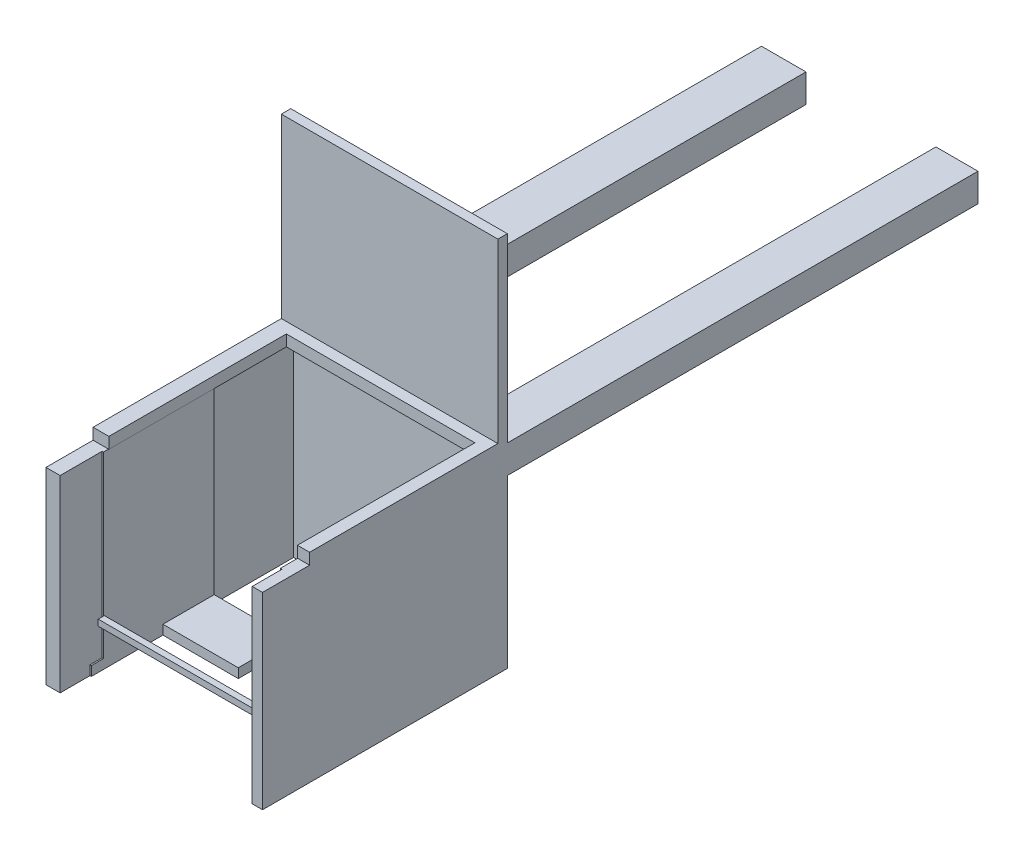
from build123d import *

# Parameters (mm, degrees)
SKETCH_1_W           = 10
SKETCH_1_H           = 200
EXTRUDE_1_DEPTH      = 230
SKETCH_3_W           = 230
SKETCH_3_H           = 10
EXTRUDE_2_DEPTH      = 200
SKETCH_4_W           = 230
SKETCH_4_H           = 200
EXTRUDE_3_DEPTH      = 250
SKETCH_5_W           = 39.107317094
SKETCH_5_H           = 28.520826202
EXTRUDE_4_DEPTH      = 600
SKETCH_6_W           = 42.946967528
SKETCH_6_H           = 25.292733119
EXTRUDE_5_DEPTH      = 600
SKETCH_8_W           = 204.071070321
SKETCH_8_H           = 31.645680933
CUT_EXTRUDE_1_DEPTH  = 600
SKETCH_9_W           = 200.890651603
SKETCH_9_H           = 63.14903284
CUT_EXTRUDE_2_DEPTH  = 600
SKETCH_10_W          = 202.520583334
SKETCH_10_H          = 86.479719268
CUT_EXTRUDE_3_DEPTH  = 600
SKETCH_11_W          = 44.998390002
SKETCH_11_H          = 54.43327072
CUT_EXTRUDE_4_DEPTH  = 600
SKETCH_12_W          = 80.01436718
SKETCH_12_H          = 54.43327072
CUT_EXTRUDE_6_DEPTH  = 190
SKETCH_13_W          = 75.520724131
SKETCH_13_H          = 54.43327072
CUT_EXTRUDE_7_DEPTH  = 190
SKETCH_14_W          = 202.325132129
SKETCH_14_H          = 13.002129503
CUT_EXTRUDE_8_DEPTH  = 190
SKETCH_15_W          = 230
SKETCH_15_H          = 11.90568545
EXTRUDE_6_DEPTH      = 200
SKETCH_16_W          = 200.306698776
SKETCH_16_H          = 188.520008931
CUT_EXTRUDE_9_DEPTH  = 50
SKETCH_17_W          = 202.636589795
SKETCH_17_H          = 13.002129503
CUT_EXTRUDE_10_DEPTH = 50
SKETCH_18_W          = 6.501064751
SKETCH_18_H          = 6.501064751
EXTRUDE_9_DEPTH      = 200
SKETCH_19_W          = 39.107317094
SKETCH_19_H          = 50
CUT_EXTRUDE_11_DEPTH = 1000
SKETCH_20_W          = 42.946967528
SKETCH_20_H          = 50
CUT_EXTRUDE_12_DEPTH = 1000
SKETCH_21_W          = 39.107317094
SKETCH_21_H          = 50
CUT_EXTRUDE_13_DEPTH = 1000
SKETCH_22_W          = 42.946967528
SKETCH_22_H          = 50
CUT_EXTRUDE_14_DEPTH = 1000
SKETCH_23_W          = 39.107317094
SKETCH_23_H          = 28.520826202
CUT_EXTRUDE_15_DEPTH = 500
SKETCH_24_W          = 42.946967528
SKETCH_24_H          = 25.292733119
CUT_EXTRUDE_16_DEPTH = 500
SKETCH_25_W          = 44.7
SKETCH_25_H          = 30
SKETCH_25_W_2        = 47.286683307
EXTRUDE_10_DEPTH     = 500


with BuildPart() as part:
    # 草图1 → 凸台-拉伸1 (new body)
    with BuildSketch(Plane(origin=(0, 0, 0), x_dir=(0, 0, -1), z_dir=(1, 0, 0))):
        with Locations((74.034934024, -49.289724413)):
            Rectangle(SKETCH_1_W, SKETCH_1_H)
    extrude(amount=EXTRUDE_1_DEPTH)

    # 草图3 → 凸台-拉伸2 (add)
    with BuildSketch(Plane.XZ.offset(149.289724413)):
        with Locations((115, -74.034934024)):
            Rectangle(SKETCH_3_W, SKETCH_3_H)
    extrude(amount=EXTRUDE_2_DEPTH)

    # 草图4 → 凸台-拉伸3 (add)
    with BuildSketch(Plane.XY.offset(-69.034934024)):
        with Locations((115, -249.289724413)):
            Rectangle(SKETCH_4_W, SKETCH_4_H)
    extrude(amount=EXTRUDE_3_DEPTH)

    # 草图5 → 凸台-拉伸4 (add)
    with BuildSketch(Plane(origin=(0, 0, -79.034934024), x_dir=(-1, 0, 0), z_dir=(0, 0, -1))):
        with Locations((-19.553658547, -97.170506203)):
            Rectangle(SKETCH_5_W, SKETCH_5_H)
    extrude(amount=EXTRUDE_4_DEPTH)

    # 草图6 → 凸台-拉伸5 (add)
    with BuildSketch(Plane(origin=(0, 0, -79.034934024), x_dir=(-1, 0, 0), z_dir=(0, 0, -1))):
        with Locations((-208.526516236, -89.203945076)):
            Rectangle(SKETCH_6_W, SKETCH_6_H)
    extrude(amount=EXTRUDE_5_DEPTH)

    # 草图8 → 切除-拉伸1 (cut)
    with BuildSketch(Plane(origin=(0, -349.289724413, 0), x_dir=(-1, 0, 0), z_dir=(0, -1, 0))):
        with Locations((-117.023802755, -165.14222551)):
            Rectangle(SKETCH_8_W, SKETCH_8_H)
    extrude(amount=-CUT_EXTRUDE_1_DEPTH, mode=Mode.SUBTRACT)

    # 草图9 → 切除-拉伸2 (cut)
    with BuildSketch(Plane(origin=(0, -349.289724413, 0), x_dir=(-1, 0, 0), z_dir=(0, -1, 0))):
        with Locations((-116.868073921, -104.74273912)):
            Rectangle(SKETCH_9_W, SKETCH_9_H)
    extrude(amount=-CUT_EXTRUDE_2_DEPTH, mode=Mode.SUBTRACT)

    # 草图10 → 切除-拉伸3 (cut)
    with BuildSketch(Plane.XZ.offset(349.289724413)):
        with Locations((115.695937766, -24.504907654)):
            Rectangle(SKETCH_10_W, SKETCH_10_H)
    extrude(amount=-CUT_EXTRUDE_3_DEPTH, mode=Mode.SUBTRACT)

    # 草图11 → 切除-拉伸4 (cut)
    with BuildSketch(Plane(origin=(0, -349.289724413, 0), x_dir=(-1, 0, 0), z_dir=(0, -1, 0))):
        with Locations((-118.936310301, -45.95158734)):
            Rectangle(SKETCH_11_W, SKETCH_11_H)
    extrude(amount=-CUT_EXTRUDE_4_DEPTH, mode=Mode.SUBTRACT)

    # 草图12 → 切除-拉伸6 (cut)
    with BuildSketch(Plane(origin=(0, -149.289724413, 0), x_dir=(1, 0, 0), z_dir=(0, 1, 0))):
        with Locations((56.42993171, -45.95158734)):
            Rectangle(SKETCH_12_W, SKETCH_12_H)
    extrude(amount=-CUT_EXTRUDE_6_DEPTH, mode=Mode.SUBTRACT)

    # 草图13 → 切除-拉伸7 (cut)
    with BuildSketch(Plane(origin=(0, -149.289724413, 0), x_dir=(1, 0, 0), z_dir=(0, 1, 0))):
        with Locations((179.195867368, -45.95158734)):
            Rectangle(SKETCH_13_W, SKETCH_13_H)
    extrude(amount=-CUT_EXTRUDE_7_DEPTH, mode=Mode.SUBTRACT)

    # 草图14 → 切除-拉伸8 (cut)
    with BuildSketch(Plane(origin=(0, -149.289724413, 0), x_dir=(1, 0, 0), z_dir=(0, 1, 0))):
        with Locations((116.150833659, -142.818320292)):
            Rectangle(SKETCH_14_W, SKETCH_14_H)
    extrude(amount=-CUT_EXTRUDE_8_DEPTH, mode=Mode.SUBTRACT)

    # 草图15 → 凸台-拉伸6 (add)
    with BuildSketch(Plane.XY.offset(-69.034934024)):
        with Locations((115, -143.336881688)):
            Rectangle(SKETCH_15_W, SKETCH_15_H)
    extrude(amount=EXTRUDE_6_DEPTH)

    # 草图16 → 切除-拉伸9 (cut)
    with BuildSketch(Plane.XZ.offset(149.289724413)):
        with Locations((116.930548552, 36.705061511)):
            Rectangle(SKETCH_16_W, SKETCH_16_H)
    extrude(amount=-CUT_EXTRUDE_9_DEPTH, mode=Mode.SUBTRACT)

    # 草图17 → 切除-拉伸10 (cut)
    with BuildSketch(Plane.XZ.offset(349.289724413)):
        with Locations((117.741043018, 142.818320292)):
            Rectangle(SKETCH_17_W, SKETCH_17_H)
    extrude(amount=-CUT_EXTRUDE_10_DEPTH, mode=Mode.SUBTRACT)

    # 草图19 → 切除-拉伸11 (cut)
    with BuildSketch(Plane(origin=(0, -82.910093102, 0), x_dir=(1, 0, 0), z_dir=(0, 1, 0))):
        with Locations((19.553658547, 654.034934024)):
            Rectangle(SKETCH_19_W, SKETCH_19_H)
    extrude(amount=-CUT_EXTRUDE_11_DEPTH, mode=Mode.SUBTRACT)

    # 草图20 → 切除-拉伸12 (cut)
    with BuildSketch(Plane(origin=(0, -76.557578516, 0), x_dir=(1, 0, 0), z_dir=(0, 1, 0))):
        with Locations((208.526516236, 654.034934024)):
            Rectangle(SKETCH_20_W, SKETCH_20_H)
    extrude(amount=-CUT_EXTRUDE_12_DEPTH, mode=Mode.SUBTRACT)

    # 草图21 → 切除-拉伸13 (cut)
    with BuildSketch(Plane(origin=(0, -82.910093102, 0), x_dir=(1, 0, 0), z_dir=(0, 1, 0))):
        with Locations((19.553658547, 604.034934024)):
            Rectangle(SKETCH_21_W, SKETCH_21_H)
    extrude(amount=-CUT_EXTRUDE_13_DEPTH, mode=Mode.SUBTRACT)

    # 草图22 → 切除-拉伸14 (cut)
    with BuildSketch(Plane(origin=(0, -76.557578516, 0), x_dir=(1, 0, 0), z_dir=(0, 1, 0))):
        with Locations((208.526516236, 604.034934024)):
            Rectangle(SKETCH_22_W, SKETCH_22_H)
    extrude(amount=-CUT_EXTRUDE_14_DEPTH, mode=Mode.SUBTRACT)

    # 草图23 → 切除-拉伸15 (cut)
    with BuildSketch(Plane(origin=(0, 0, -579.034934024), x_dir=(-1, 0, 0), z_dir=(0, 0, -1))):
        with Locations((-19.553658547, -97.170506203)):
            Rectangle(SKETCH_23_W, SKETCH_23_H)
    extrude(amount=-CUT_EXTRUDE_15_DEPTH, mode=Mode.SUBTRACT)

    # 草图24 → 切除-拉伸16 (cut)
    with BuildSketch(Plane(origin=(0, 0, -579.034934024), x_dir=(-1, 0, 0), z_dir=(0, 0, -1))):
        with Locations((-208.526516236, -89.203945076)):
            Rectangle(SKETCH_24_W, SKETCH_24_H)
    extrude(amount=-CUT_EXTRUDE_16_DEPTH, mode=Mode.SUBTRACT)

    # 草图25 → 凸台-拉伸10 (add)
    with BuildSketch(Plane(origin=(0, 0, -79.034934024), x_dir=(-1, 0, 0), z_dir=(0, 0, -1))):
        with Locations((-207.65, -156.843853199)):
            Rectangle(SKETCH_25_W, SKETCH_25_H)
        with Locations((-23.643341654, -156.843853199)):
            Rectangle(SKETCH_25_W_2, SKETCH_25_H)
    extrude(amount=EXTRUDE_10_DEPTH)


with BuildPart() as body_2:
    # 草图18 → 凸台-拉伸9 (new body)
    with BuildSketch(Plane.ZY.offset(-217.313399723)):
        with Locations((139.567787916, -302.540256789)):
            Rectangle(SKETCH_18_W, SKETCH_18_H)
    extrude(amount=EXTRUDE_9_DEPTH)


solid = Compound([part.part, body_2.part])
